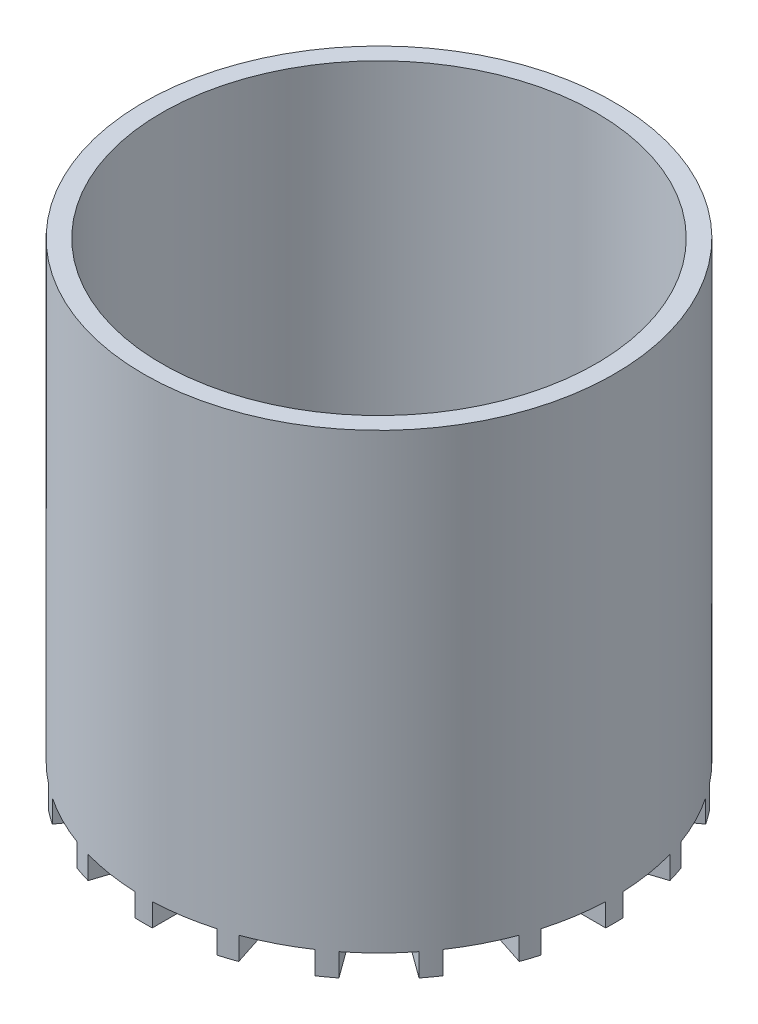
from build123d import *

# Parameters (mm, degrees)
SKETCH1_R               = 38.1
BOSS_EXTRUDE1_DEPTH     = 76.2
SHELL2_T                = 3.175
SKETCH2_W               = 3
SKETCH2_H               = 82.55
SKETCH2_W_2             = 82.55
SKETCH2_H_2             = 3
BOSS_EXTRUDE2_DEPTH     = 4
CUT_EXTRUDE1_DEPTH      = 99.527366122
CUT_EXTRUDE1_DEPTH_BACK = 99.527366122
SKETCH3_R               = 61.906276858
SKETCH3_R_2             = 41.275
SKETCH4_R               = 20.64
CUT_EXTRUDE2_DEPTH      = 4


with BuildPart() as part:
    # Sketch1 → Boss-Extrude1 (new body)
    with BuildSketch(Plane(origin=(0, 0, 0), x_dir=(1, 0, 0), z_dir=(0, 1, 0))):
        Circle(SKETCH1_R)
    extrude(amount=BOSS_EXTRUDE1_DEPTH)

    # Shell2
    shell2_openings = [part.faces().sort_by_distance(p)[0] for p in [
        (0, 76.2, 0),
    ]]
    offset(amount=SHELL2_T, openings=shell2_openings, kind=Kind.INTERSECTION)

    # Sketch2 → Boss-Extrude2 (add)
    with BuildSketch(Plane(origin=(0, -3.175, 0), x_dir=(-1, 0, 0), z_dir=(0, -1, 0))):
        Rectangle(SKETCH2_W, SKETCH2_H)
        Polygon((-23.047310797, -34.273854321), (25.47436178, 32.510498564), (23.047310797, 34.273854321), (-25.47436178, -32.510498564), align=None)
        Polygon((-38.791332219, -14.181261217), (39.718383202, 11.328091668), (38.791332219, 14.181261217), (-39.718383202, -11.328091668), align=None)
        Polygon((-39.718383202, 11.328091668), (38.791332219, -14.181261217), (39.718383202, -11.328091668), (-38.791332219, 14.181261217), align=None)
        Polygon((-25.47436178, 32.510498564), (23.047310797, -34.273854321), (25.47436178, -32.510498564), (-23.047310797, 34.273854321), align=None)
        Polygon((-14.181261217, 38.791332219), (11.328091668, -39.718383202), (14.181261217, -38.791332219), (-11.328091668, 39.718383202), align=None)
        Polygon((11.328091668, 39.718383202), (-14.181261217, -38.791332219), (-11.328091668, -39.718383202), (14.181261217, 38.791332219), align=None)
        Polygon((32.510498564, 25.47436178), (-34.273854321, -23.047310797), (-32.510498564, -25.47436178), (34.273854321, 23.047310797), align=None)
        Rectangle(SKETCH2_W_2, SKETCH2_H_2)
        Polygon((-34.273854321, 23.047310797), (32.510498564, -25.47436178), (34.273854321, -23.047310797), (-32.510498564, 25.47436178), align=None)
    extrude(amount=BOSS_EXTRUDE2_DEPTH)

    # Sketch3 → Cut-Extrude1 (cut, two sides: drawn at the far end of the back side and taken through both)
    with BuildSketch(Plane.XZ.offset(3.175).offset(-CUT_EXTRUDE1_DEPTH_BACK)):
        Circle(SKETCH3_R)
        Circle(SKETCH3_R_2, mode=Mode.SUBTRACT)
    extrude(amount=CUT_EXTRUDE1_DEPTH + CUT_EXTRUDE1_DEPTH_BACK, mode=Mode.SUBTRACT)

    # Sketch4 → Cut-Extrude2 (cut)
    with BuildSketch(Plane.XZ.offset(7.175)):
        Circle(SKETCH4_R)
    extrude(amount=-CUT_EXTRUDE2_DEPTH, mode=Mode.SUBTRACT)


solid = part.part
